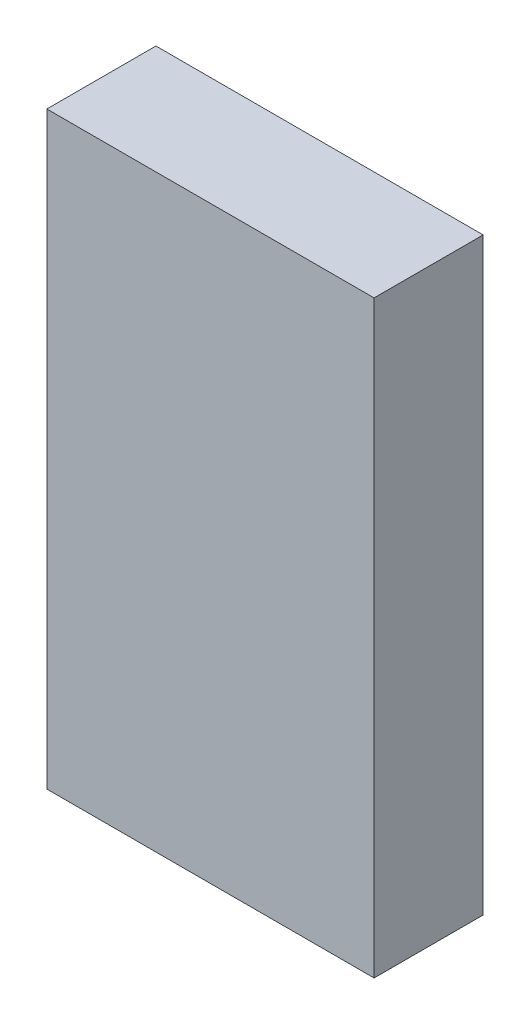
from build123d import *

# Parameters (mm, degrees)
SKETCH1_W           = 15
SKETCH1_H           = 27
BOSS_EXTRUDE1_DEPTH = 5


with BuildPart() as part:
    # Sketch1 → Boss-Extrude1 (new body)
    with BuildSketch(Plane.XY):
        with Locations((7.5, 13.5)):
            Rectangle(SKETCH1_W, SKETCH1_H)
    extrude(amount=BOSS_EXTRUDE1_DEPTH)


solid = part.part
